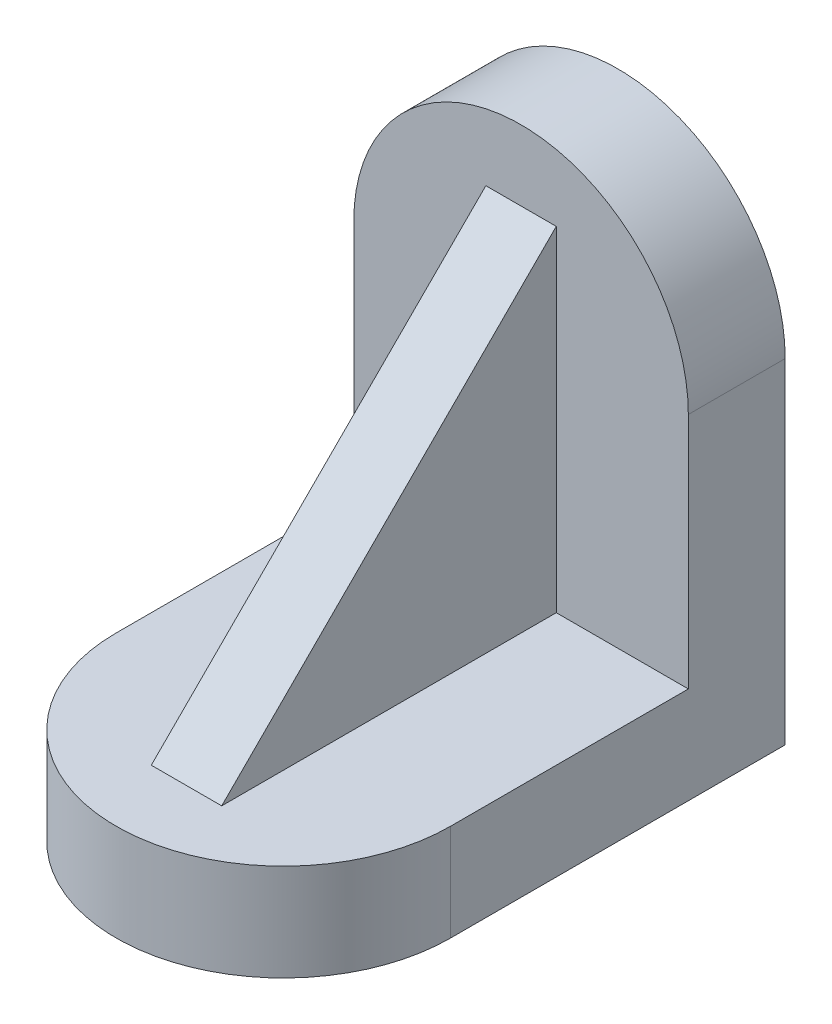
from build123d import *

# Parameters (mm, degrees)
BOSS_EXTRUDE1_DEPTH = 11
BOSS_EXTRUDE4_DEPTH = 11
RIB1_REACH          = 73.091
SKETCH9_WALL_W      = 197.923096068
SKETCH9_WALL_H      = 8


with BuildPart() as part:
    # Sketch2 → Boss-Extrude1 (new body)
    with BuildSketch(Plane(origin=(0, 0, 0), x_dir=(1, 0, 0), z_dir=(0, 1, 0))):
        with BuildLine():
            Line((0, 0), (0, 38))
            Line((0, 38), (38, 38))
            Line((38, 38), (38, 0))
            ThreePointArc((38, 0), (19, -19), (0, 0))
        make_face()
    extrude(amount=BOSS_EXTRUDE1_DEPTH)

    # Sketch3 → Boss-Extrude4 (add)
    with BuildSketch(Plane(origin=(0, 0, -38), x_dir=(-1, 0, 0), z_dir=(0, 0, -1))):
        with BuildLine():
            Line((-38, 0), (0, 0))
            Line((0, 0), (0, 38))
            ThreePointArc((0, 38), (-19, 57), (-38, 38))
            Line((-38, 38), (-38, 0))
        make_face()
    extrude(amount=-BOSS_EXTRUDE4_DEPTH)

    # Sketch9 wall → Rib1 (add, up to next)
    with BuildSketch(Plane(origin=(19, 30, -8), x_dir=(0, -0.707106781187, 0.707106781187), z_dir=(0, 0.707106781187, 0.707106781187)), mode=Mode.PRIVATE) as rib1_sk1:
        Rectangle(SKETCH9_WALL_W, SKETCH9_WALL_H)
    rib1_tool1 = extrude(rib1_sk1.sketch, amount=-RIB1_REACH, mode=Mode.PRIVATE) - part.part
    add(rib1_tool1.solids().sort_by_distance((19, 30, -8))[0])


solid = part.part
